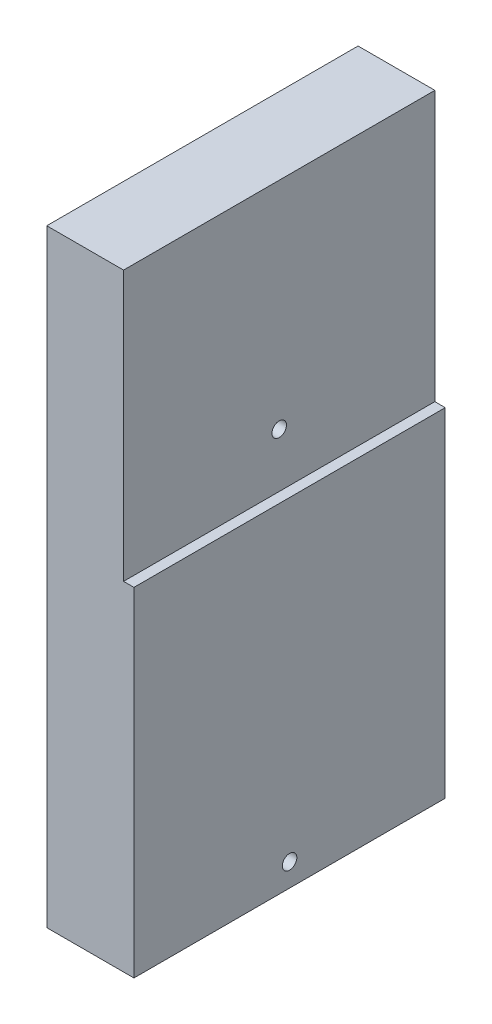
from build123d import *

# Parameters (mm, degrees)
BOSS_EXTRUDE1_DEPTH = 75
SKETCH2_R           = 1.75
CUT_EXTRUDE1_DEPTH  = 25
SKETCH4_R           = 1.75
CUT_EXTRUDE3_DEPTH  = 25
SKETCH5_R           = 2.1
CUT_EXTRUDE4_DEPTH  = 10


with BuildPart() as part:
    # Sketch1 → Boss-Extrude1 (new body)
    with BuildSketch(Plane.XY):
        Polygon((-20, 159.45), (-20, 13), (0, 13), (1, 13), (1, 94.5), (-1.5, 94.5), (-1.5, 159.45), align=None)
    extrude(amount=BOSS_EXTRUDE1_DEPTH)

    # Sketch2 → Cut-Extrude1 (cut)
    with BuildSketch(Plane(origin=(1, 0, 0), x_dir=(0, 0, -1), z_dir=(1, 0, 0))):
        with Locations((-37.5, 18.5)):
            Circle(SKETCH2_R)
    extrude(amount=-CUT_EXTRUDE1_DEPTH, mode=Mode.SUBTRACT)

    # Sketch4 → Cut-Extrude3 (cut)
    with BuildSketch(Plane(origin=(-1.5, 0, 0), x_dir=(0, 0, -1), z_dir=(1, 0, 0))):
        with Locations((-37.5, 107.5)):
            Circle(SKETCH4_R)
    extrude(amount=-CUT_EXTRUDE3_DEPTH, mode=Mode.SUBTRACT)

    # Sketch5 → Cut-Extrude4 (cut)
    with BuildSketch(Plane.XZ.offset(-13)):
        with Locations(Location((-9.5, 50, 0), (0, 0, 270))):
            Circle(SKETCH5_R)
        with Locations(Location((-9.5, 25, 0), (0, 0, 270))):
            Circle(SKETCH5_R)
    extrude(amount=-CUT_EXTRUDE4_DEPTH, mode=Mode.SUBTRACT)


solid = part.part
